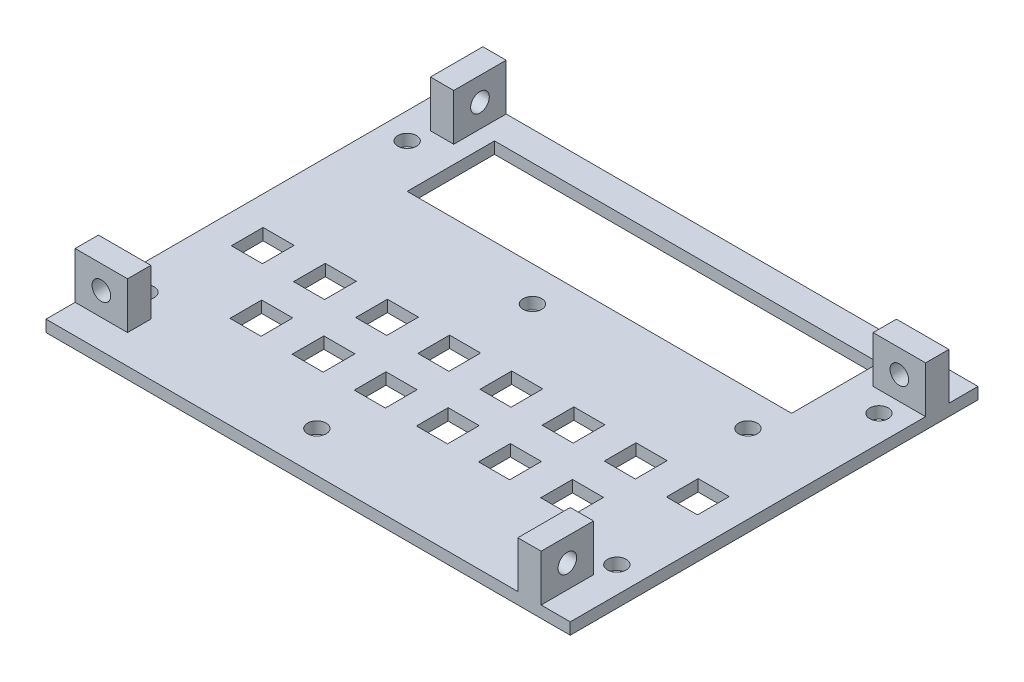
from build123d import *

# Parameters (mm, degrees)
ESBO_O1_W                = 90
ESBO_O1_H                = 70
RESSALTO_EXTRUS_O1_DEPTH = 2
ESBO_O3_W                = 4
ESBO_O3_H                = 9
ESBO_O3_W_2              = 9
ESBO_O3_H_2              = 4
RESSALTO_EXTRUS_O4_DEPTH = 8
ESBO_O6_W                = 66
ESBO_O6_H                = 15
CORTE_EXTRUS_O4_DEPTH    = 3
ESBO_O7_R                = 1.6
CORTE_EXTRUS_O7_DEPTH    = 3
ESBO_O8_R                = 1.6
CORTE_EXTRUS_O8_DEPTH    = 5
ESBO_O9_R                = 1.6
CORTE_EXTRUS_O9_DEPTH    = 5
ESBO_O10_R               = 1.6
CORTE_EXTRUS_O10_DEPTH   = 5
ESBO_O11_R               = 1.6
CORTE_EXTRUS_O11_DEPTH   = 5
ESBO_O12_R               = 1.6
CORTE_EXTRUS_O12_DEPTH   = 58.567351858
ESBO_O2_W                = 5.334
ESBO_O2_H                = 5.45
CORTE_EXTRUS_O13_DEPTH   = 58.567351858


with BuildPart() as part:
    # Esboço1 → Ressalto-extrusão1 (new body)
    with BuildSketch(Plane(origin=(0, 0, 0), x_dir=(1, 0, 0), z_dir=(0, 1, 0))):
        Rectangle(ESBO_O1_W, ESBO_O1_H)
    extrude(amount=RESSALTO_EXTRUS_O1_DEPTH)

    # Esboço3 → Ressalto-extrusão4 (add)
    with BuildSketch(Plane(origin=(0, 2, 0), x_dir=(1, 0, 0), z_dir=(0, 1, 0))):
        with Locations((-38, 30.5)):
            Rectangle(ESBO_O3_W, ESBO_O3_H)
        with Locations((40.5, 28)):
            Rectangle(ESBO_O3_W_2, ESBO_O3_H_2)
        with Locations((38, -30.5)):
            Rectangle(ESBO_O3_W, ESBO_O3_H)
        with Locations((-40.5, -28)):
            Rectangle(ESBO_O3_W_2, ESBO_O3_H_2)
    extrude(amount=RESSALTO_EXTRUS_O4_DEPTH)

    # Esboço6 → Corte-extrusão4 (cut)
    with BuildSketch(Plane.XZ):
        with Locations((0, -22.5)):
            Rectangle(ESBO_O6_W, ESBO_O6_H)
    extrude(amount=-CORTE_EXTRUS_O4_DEPTH, mode=Mode.SUBTRACT)

    # Esboço7 → Corte-extrusão7 (cut)
    with BuildSketch(Plane(origin=(0, 2, 0), x_dir=(1, 0, 0), z_dir=(0, 1, 0))):
        with Locations(Location((31.5, 9, 0), (0, 0, 270))):
            Circle(ESBO_O7_R)
        with Locations(Location((-5.5, 9, 0), (0, 0, 270))):
            Circle(ESBO_O7_R)
        with Locations(Location((-5.5, -28, 0), (0, 0, 270))):
            Circle(ESBO_O7_R)
        with Locations(Location((31.5, -28, 0), (0, 0, 270))):
            Circle(ESBO_O7_R)
    extrude(amount=-CORTE_EXTRUS_O7_DEPTH, mode=Mode.SUBTRACT)

    # Esboço8 → Corte-extrusão8 (cut)
    with BuildSketch(Plane(origin=(0, 0, -30), x_dir=(-1, 0, 0), z_dir=(0, 0, -1))):
        with Locations((-40.5, 6)):
            Circle(ESBO_O8_R)
    extrude(amount=-CORTE_EXTRUS_O8_DEPTH, mode=Mode.SUBTRACT)

    # Esboço9 → Corte-extrusão9 (cut)
    with BuildSketch(Plane.ZY.offset(40)):
        with Locations((-30.5, 6)):
            Circle(ESBO_O9_R)
    extrude(amount=-CORTE_EXTRUS_O9_DEPTH, mode=Mode.SUBTRACT)

    # Esboço10 → Corte-extrusão10 (cut)
    with BuildSketch(Plane.XY.offset(30)):
        with Locations((-40.5, 6)):
            Circle(ESBO_O10_R)
    extrude(amount=-CORTE_EXTRUS_O10_DEPTH, mode=Mode.SUBTRACT)

    # Esboço11 → Corte-extrusão11 (cut)
    with BuildSketch(Plane(origin=(40, 0, 0), x_dir=(0, 0, -1), z_dir=(1, 0, 0))):
        with Locations((-30.5, 6)):
            Circle(ESBO_O11_R)
    extrude(amount=-CORTE_EXTRUS_O11_DEPTH, mode=Mode.SUBTRACT)

    # Esboço12 → Corte-extrusão12 (cut, through all)
    with BuildSketch(Plane(origin=(0, 2, 0), x_dir=(1, 0, 0), z_dir=(0, 1, 0))):
        with Locations(Location((-40.5, 22.5, 0), (0, 0, 270))):
            Circle(ESBO_O12_R)
        with Locations(Location((-40.5, -22.5, 0), (0, 0, 270))):
            Circle(ESBO_O12_R)
        with Locations(Location((40.5, -22.5, 0), (0, 0, 270))):
            Circle(ESBO_O12_R)
        with Locations(Location((40.5, 22.5, 0), (0, 0, 270))):
            Circle(ESBO_O12_R)
    extrude(amount=-CORTE_EXTRUS_O12_DEPTH, mode=Mode.SUBTRACT)

    # Esboço2 → Corte-extrusão13 (cut, through all)
    with BuildSketch(Plane(origin=(0, 2, 0), x_dir=(1, 0, 0), z_dir=(0, 1, 0))):
        with Locations((-26.663, -5.455)):
            Rectangle(ESBO_O2_W, ESBO_O2_H)
        with Locations((-15.993, -5.455)):
            Rectangle(ESBO_O2_W, ESBO_O2_H)
        with Locations((-5.323, -5.455)):
            Rectangle(ESBO_O2_W, ESBO_O2_H)
        with Locations((5.347, -5.455)):
            Rectangle(ESBO_O2_W, ESBO_O2_H)
        with Locations((16.017, -5.455)):
            Rectangle(ESBO_O2_W, ESBO_O2_H)
        with Locations((26.687, -5.455)):
            Rectangle(ESBO_O2_W, ESBO_O2_H)
        with Locations((37.357, -5.455)):
            Rectangle(ESBO_O2_W, ESBO_O2_H)
        with Locations((-26.663, -16.365)):
            Rectangle(ESBO_O2_W, ESBO_O2_H)
        with Locations((-15.993, -16.365)):
            Rectangle(ESBO_O2_W, ESBO_O2_H)
        with Locations((-5.323, -16.365)):
            Rectangle(ESBO_O2_W, ESBO_O2_H)
        with Locations((5.347, -16.365)):
            Rectangle(ESBO_O2_W, ESBO_O2_H)
        with Locations((16.017, -16.365)):
            Rectangle(ESBO_O2_W, ESBO_O2_H)
        with Locations((26.687, -16.365)):
            Rectangle(ESBO_O2_W, ESBO_O2_H)
        with Locations((-37.333, -5.455)):
            Rectangle(ESBO_O2_W, ESBO_O2_H)
    extrude(amount=-CORTE_EXTRUS_O13_DEPTH, mode=Mode.SUBTRACT)


solid = part.part
